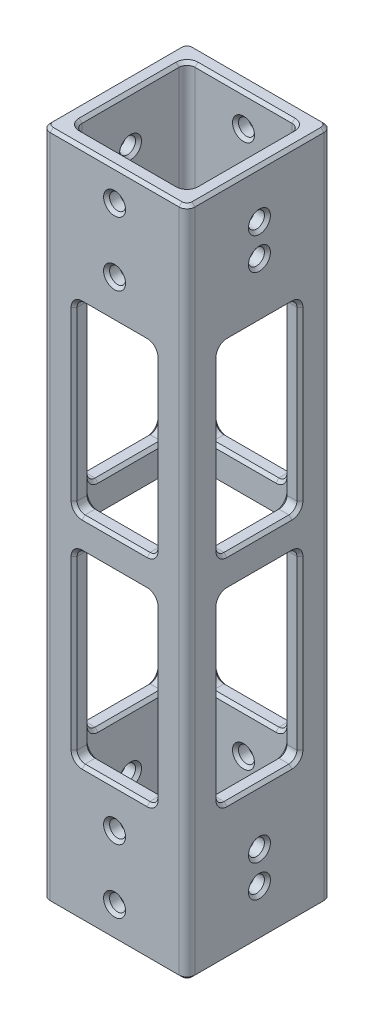
from build123d import *

# Parameters (mm, degrees)
SKETCH1_W                    = 28.7782
SKETCH1_H                    = 28.7782
SKETCH1_W_2                  = 22.4409
SKETCH1_H_2                  = 22.4409
BOSS_EXTRUDE1_DEPTH          = 66.675
F_1_8_0_125_DIAMETER_HOLE1_D = 3.175
F_1_8_0_125_DIAMETER_HOLE2_D = 3.175
F_1_8_0_125_DIAMETER_HOLE3_D = 3.175
CUT_EXTRUDE1_REACH           = 71.711
SKETCH15_W                   = 16.0782
SKETCH15_H                   = 36.5125
CIRPATTERN2_COUNT            = 4
FILLET1_1_32_OUTER_INNER_R   = 1.5875
FILLET1_1_32_HOLES_R         = 1.5875
CHAMFER2_3_128_SIZE          = 0.5953125


with BuildPart() as part:
    # Sketch1 → Boss-Extrude1 (new, symmetric)
    with BuildSketch(Plane(origin=(0, 0, 0), x_dir=(1, 0, 0), z_dir=(0, 1, 0))):
        Rectangle(SKETCH1_W, SKETCH1_H)
        Rectangle(SKETCH1_W_2, SKETCH1_H_2, mode=Mode.SUBTRACT)
    extrude(amount=BOSS_EXTRUDE1_DEPTH, both=True)

    # 1/8 (0.125) Diameter Hole1 (through all)
    with Locations(Plane.ZY.offset(14.3891)):
        with Locations((0, 57.15), (0, 50.8)):
            Hole(F_1_8_0_125_DIAMETER_HOLE1_D / 2)

    # 1/8 (0.125) Diameter Hole2 (through all)
    with Locations(Plane(origin=(14.3891, 0, 0), x_dir=(0, 0, -1), z_dir=(1, 0, 0))):
        with Locations((0, -50.8), (0, -57.15)):
            Hole(F_1_8_0_125_DIAMETER_HOLE2_D / 2)

    # 1/8 (0.125) Diameter Hole3 (through all)
    with Locations(Plane.XY.offset(14.3891)):
        with Locations((0, 60.325), (0, 47.625), (0, -47.625), (0, -60.325)):
            Hole(F_1_8_0_125_DIAMETER_HOLE3_D / 2)

    # Sketch15 → Cut-Extrude1 (cut, up to next)
    with BuildSketch(Plane.XY, mode=Mode.PRIVATE) as cut_extrude1_sk1:
        with Locations((0, 21.43125)):
            Rectangle(SKETCH15_W, SKETCH15_H)
    cut_extrude1_tool1 = extrude(cut_extrude1_sk1.sketch, amount=-CUT_EXTRUDE1_REACH, mode=Mode.PRIVATE) & part.part
    # Sketch15 → Cut-Extrude1 (cut, up to next)
    with BuildSketch(Plane.XY, mode=Mode.PRIVATE) as cut_extrude1_sk2:
        with Locations((0, -21.43125)):
            Rectangle(SKETCH15_W, SKETCH15_H)
    cut_extrude1_tool2 = extrude(cut_extrude1_sk2.sketch, amount=-CUT_EXTRUDE1_REACH, mode=Mode.PRIVATE) & part.part
    cut_extrude1_1 = cut_extrude1_tool1.solids().sort_by_distance((0, 21.43125, 0))[0]
    add(cut_extrude1_1, mode=Mode.SUBTRACT)
    cut_extrude1_2 = cut_extrude1_tool2.solids().sort_by_distance((0, -21.43125, 0))[0]
    add(cut_extrude1_2, mode=Mode.SUBTRACT)
    cut_extrude1 = cut_extrude1_1 + cut_extrude1_2  # Cut-Extrude1 as one shape, for the pattern or mirror that repeats it

    # CirPattern2: Cut-Extrude1 ×4 about axis
    cirpattern2_axis = Axis((0, 0, 0), (0, 1, 0))
    for i in range(1, CIRPATTERN2_COUNT):
        add(cut_extrude1.rotate(cirpattern2_axis, i * 360 / CIRPATTERN2_COUNT), mode=Mode.SUBTRACT)

    # Fillet1_1/32_Outer&Inner)
    fillet1_1_32_outer_inner_edges = [part.edges().sort_by_distance(p)[0] for p in [
        (11.22045, 0, 11.22045),
        (11.22045, 0, -11.22045),
        (-11.22045, 0, -11.22045),
        (-11.22045, 0, 11.22045),
        (14.3891, 0, 14.3891),
        (-14.3891, 0, 14.3891),
        (-14.3891, 0, -14.3891),
        (14.3891, 0, -14.3891),
    ]]
    fillet(fillet1_1_32_outer_inner_edges, radius=FILLET1_1_32_OUTER_INNER_R)

    # Fillet1_1/32_(holes)
    fillet1_1_32_holes_edges = [part.edges().sort_by_distance(p)[0] for p in [
        (-8.0391, 3.175, -12.804775),
        (-8.0391, 39.6875, -12.804775),
        (8.0391, 39.6875, -12.804775),
        (8.0391, 3.175, -12.804775),
        (8.0391, -39.6875, -12.804775),
        (-8.0391, -39.6875, -12.804775),
        (-8.0391, -3.175, -12.804775),
        (8.0391, -3.175, -12.804775),
        (12.804775, 3.175, -8.0391),
        (12.804775, 39.6875, -8.0391),
        (12.804775, 39.6875, 8.0391),
        (12.804775, 3.175, 8.0391),
        (-8.0391, -39.6875, 12.804775),
        (8.0391, -39.6875, 12.804775),
        (8.0391, -3.175, 12.804775),
        (-8.0391, -3.175, 12.804775),
        (8.0391, 3.175, 12.804775),
        (8.0391, 39.6875, 12.804775),
        (-8.0391, 39.6875, 12.804775),
        (-8.0391, 3.175, 12.804775),
        (-12.804775, -39.6875, -8.0391),
        (-12.804775, -39.6875, 8.0391),
        (-12.804775, -3.175, 8.0391),
        (-12.804775, -3.175, -8.0391),
        (12.804775, -39.6875, 8.0391),
        (12.804775, -39.6875, -8.0391),
        (12.804775, -3.175, -8.0391),
        (12.804775, -3.175, 8.0391),
        (-12.804775, 3.175, 8.0391),
        (-12.804775, 39.6875, 8.0391),
        (-12.804775, 39.6875, -8.0391),
        (-12.804775, 3.175, -8.0391),
    ]]
    fillet(fillet1_1_32_holes_edges, radius=FILLET1_1_32_HOLES_R)

    # Chamfer2_3/128
    chamfer2_3_128_edges = [part.edges().sort_by_distance(p)[0] for p in [
        (0, -66.675, -14.3891),
        (0, 66.675, -14.3891),
        (14.3891, -66.675, 0),
        (0, -66.675, 14.3891),
        (-14.3891, -66.675, 0),
        (0, -66.675, 11.22045),
        (11.22045, -66.675, 0),
        (0, -66.675, -11.22045),
        (-11.22045, -66.675, 0),
        (-13.924132015, -66.675, 13.924132015),
        (-13.924132015, -66.675, -13.924132015),
        (13.924132015, -66.675, 13.924132015),
        (13.924132015, -66.675, -13.924132015),
        (14.3891, 66.675, 0),
        (-14.3891, 66.675, 0),
        (0, 66.675, 14.3891),
        (11.22045, 66.675, 0),
        (0, 66.675, 11.22045),
        (-11.22045, 66.675, 0),
        (0, 66.675, -11.22045),
        (-13.924132015, 66.675, 13.924132015),
        (-13.924132015, 66.675, -13.924132015),
        (13.924132015, 66.675, 13.924132015),
        (13.924132015, 66.675, -13.924132015),
        (10.755482015, -66.675, -10.755482015),
        (10.755482015, 66.675, -10.755482015),
        (10.755482015, -66.675, 10.755482015),
        (10.755482015, 66.675, 10.755482015),
        (-10.755482015, -66.675, 10.755482015),
        (-10.755482015, 66.675, 10.755482015),
        (-10.755482015, -66.675, -10.755482015),
        (-10.755482015, 66.675, -10.755482015),
        (-14.3891, -39.6875, 0),
        (-11.22045, -39.6875, 0),
        (-14.3891, -21.43125, 8.0391),
        (-11.22045, -21.43125, 8.0391),
        (-14.3891, -21.43125, -8.0391),
        (-11.22045, -21.43125, -8.0391),
        (-14.3891, -3.175, 0),
        (-11.22045, -3.175, 0),
        (-14.3891, 21.43125, -8.0391),
        (-11.22045, 21.43125, -8.0391),
        (-14.3891, 3.175, 0),
        (-11.22045, 3.175, 0),
        (-14.3891, 21.43125, 8.0391),
        (-11.22045, 21.43125, 8.0391),
        (-14.3891, 39.6875, 0),
        (-11.22045, 39.6875, 0),
        (-8.0391, 21.43125, -14.3891),
        (-8.0391, 21.43125, -11.22045),
        (0, 39.6875, -14.3891),
        (0, 39.6875, -11.22045),
        (8.0391, 21.43125, -14.3891),
        (8.0391, 21.43125, -11.22045),
        (0, -3.175, -14.3891),
        (0, -3.175, -11.22045),
        (8.0391, -21.43125, -14.3891),
        (8.0391, -21.43125, -11.22045),
        (-8.0391, -21.43125, -14.3891),
        (-8.0391, -21.43125, -11.22045),
        (0, 3.175, -14.3891),
        (0, 3.175, -11.22045),
        (0, -39.6875, -14.3891),
        (0, -39.6875, -11.22045),
        (14.3891, -21.43125, 8.0391),
        (11.22045, -21.43125, 8.0391),
        (14.3891, -39.6875, 0),
        (11.22045, -39.6875, 0),
        (14.3891, -21.43125, -8.0391),
        (11.22045, -21.43125, -8.0391),
        (14.3891, 3.175, 0),
        (11.22045, 3.175, 0),
        (14.3891, 21.43125, -8.0391),
        (11.22045, 21.43125, -8.0391),
        (14.3891, 21.43125, 8.0391),
        (11.22045, 21.43125, 8.0391),
        (14.3891, -3.175, 0),
        (11.22045, -3.175, 0),
        (14.3891, 39.6875, 0),
        (11.22045, 39.6875, 0),
        (0, 39.6875, 14.3891),
        (0, 39.6875, 11.22045),
        (-8.0391, 21.43125, 14.3891),
        (-8.0391, 21.43125, 11.22045),
        (8.0391, 21.43125, 14.3891),
        (8.0391, 21.43125, 11.22045),
        (8.0391, -21.43125, 14.3891),
        (8.0391, -21.43125, 11.22045),
        (0, -3.175, 14.3891),
        (0, -3.175, 11.22045),
        (-11.22045, 50.8, 1.5875),
        (-8.0391, -21.43125, 14.3891),
        (11.22045, 50.8, 1.5875),
        (-8.0391, -21.43125, 11.22045),
        (14.3891, 50.8, 1.5875),
        (0, 3.175, 14.3891),
        (-14.3891, 50.8, 1.5875),
        (0, 3.175, 11.22045),
        (0, -39.6875, 14.3891),
        (0, -39.6875, 11.22045),
        (-11.22045, -39.222532015, 7.574132015),
        (-14.3891, -39.222532015, 7.574132015),
        (-11.22045, -39.222532015, -7.574132015),
        (-14.3891, -39.222532015, -7.574132015),
        (-11.22045, -3.639967985, -7.574132015),
        (-14.3891, -3.639967985, -7.574132015),
        (-11.22045, -3.639967985, 7.574132015),
        (-14.3891, -3.639967985, 7.574132015),
        (-11.22045, 3.639967985, -7.574132015),
        (-14.3891, 3.639967985, -7.574132015),
        (-11.22045, 3.639967985, 7.574132015),
        (-14.3891, 3.639967985, 7.574132015),
        (-11.22045, 39.222532015, 7.574132015),
        (-14.3891, 39.222532015, 7.574132015),
        (-11.22045, 39.222532015, -7.574132015),
        (-14.3891, 39.222532015, -7.574132015),
        (-7.574132015, 39.222532015, -11.22045),
        (-7.574132015, 39.222532015, -14.3891),
        (7.574132015, 39.222532015, -11.22045),
        (7.574132015, 39.222532015, -14.3891),
        (7.574132015, -3.639967985, -11.22045),
        (7.574132015, -3.639967985, -14.3891),
        (-7.574132015, -3.639967985, -11.22045),
        (-7.574132015, -3.639967985, -14.3891),
        (7.574132015, 3.639967985, -11.22045),
        (7.574132015, 3.639967985, -14.3891),
        (-7.574132015, 3.639967985, -11.22045),
        (-7.574132015, 3.639967985, -14.3891),
        (-7.574132015, -39.222532015, -11.22045),
        (-7.574132015, -39.222532015, -14.3891),
        (7.574132015, -39.222532015, -11.22045),
        (7.574132015, -39.222532015, -14.3891),
        (11.22045, -39.222532015, 7.574132015),
        (14.3891, -39.222532015, 7.574132015),
        (11.22045, -39.222532015, -7.574132015),
        (14.3891, -39.222532015, -7.574132015),
        (11.22045, 3.639967985, -7.574132015),
        (14.3891, 3.639967985, -7.574132015),
        (11.22045, 3.639967985, 7.574132015),
        (14.3891, 3.639967985, 7.574132015),
        (11.22045, -3.639967985, 7.574132015),
        (14.3891, -3.639967985, 7.574132015),
        (11.22045, -3.639967985, -7.574132015),
        (14.3891, -3.639967985, -7.574132015),
        (11.22045, 39.222532015, -7.574132015),
        (14.3891, 39.222532015, -7.574132015),
        (11.22045, 39.222532015, 7.574132015),
        (14.3891, 39.222532015, 7.574132015),
        (-7.574132015, 39.222532015, 11.22045),
        (-7.574132015, 39.222532015, 14.3891),
        (7.574132015, 39.222532015, 11.22045),
        (7.574132015, 39.222532015, 14.3891),
        (7.574132015, -3.639967985, 11.22045),
        (7.574132015, -3.639967985, 14.3891),
        (-7.574132015, -3.639967985, 11.22045),
        (-7.574132015, -3.639967985, 14.3891),
        (7.574132015, 3.639967985, 11.22045),
        (7.574132015, 3.639967985, 14.3891),
        (-7.574132015, 3.639967985, 11.22045),
        (-7.574132015, 3.639967985, 14.3891),
        (7.574132015, -39.222532015, 11.22045),
        (7.574132015, -39.222532015, 14.3891),
        (-7.574132015, -39.222532015, 11.22045),
        (-7.574132015, -39.222532015, 14.3891),
        (11.22045, 57.15, 1.5875),
        (-11.22045, 57.15, 1.5875),
        (-14.3891, 57.15, 1.5875),
        (14.3891, 57.15, 1.5875),
        (-11.22045, -57.15, -1.5875),
        (11.22045, -57.15, -1.5875),
        (14.3891, -57.15, -1.5875),
        (-14.3891, -57.15, -1.5875),
        (-11.22045, -50.8, -1.5875),
        (11.22045, -50.8, -1.5875),
        (14.3891, -50.8, -1.5875),
        (-14.3891, -50.8, -1.5875),
        (1.5875, -60.325, -11.22045),
        (1.5875, -60.325, 11.22045),
        (1.5875, -60.325, 14.3891),
        (1.5875, -60.325, -14.3891),
        (1.5875, -47.625, -11.22045),
        (1.5875, -47.625, 11.22045),
        (1.5875, -47.625, 14.3891),
        (1.5875, -47.625, -14.3891),
        (1.5875, 47.625, 11.22045),
        (1.5875, 47.625, -11.22045),
        (1.5875, 47.625, -14.3891),
        (1.5875, 47.625, 14.3891),
        (1.5875, 60.325, 11.22045),
        (1.5875, 60.325, -11.22045),
        (1.5875, 60.325, -14.3891),
        (1.5875, 60.325, 14.3891),
    ]]
    chamfer(chamfer2_3_128_edges, length=CHAMFER2_3_128_SIZE)


solid = part.part
